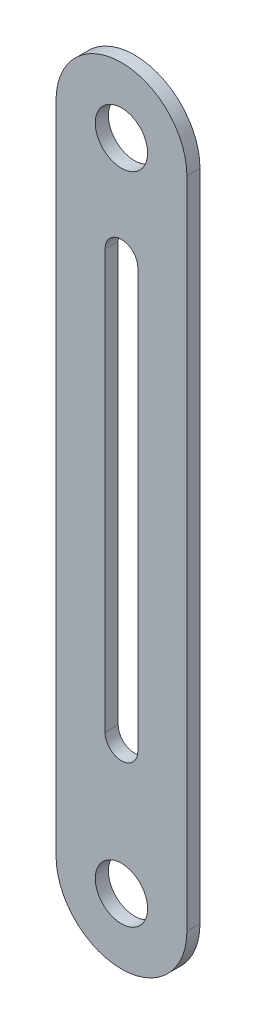
from build123d import *

# Parameters (mm, degrees)
SKETCH_1_R          = 8
EXTRUDE_1_DEPTH     = 4
CUT_EXTRUDE_2_DEPTH = 221.943431674


with BuildPart() as part:
    # 草图1 → 凸台-拉伸1 (new body)
    with BuildSketch(Plane.XY):
        with BuildLine():
            Line((-20, 0), (-20, -200))
            ThreePointArc((-20, -200), (0, -220), (20, -200))
            Line((20, -200), (20, 0))
            ThreePointArc((20, 0), (0, 20), (-20, 0))
        make_face()
        Circle(SKETCH_1_R, mode=Mode.SUBTRACT)
        with Locations((0, -200)):
            Circle(SKETCH_1_R, mode=Mode.SUBTRACT)
    extrude(amount=EXTRUDE_1_DEPTH)

    # 草图2 → 切除-拉伸2 (cut, through all)
    with BuildSketch(Plane.XY.offset(4)):
        with BuildLine():
            Line((-5, -31.845004689), (-5, -159.845004689))
            ThreePointArc((-5, -159.845004689), (0, -164.845004689), (5, -159.845004689))
            Line((5, -159.845004689), (5, -31.845004689))
            ThreePointArc((5, -31.845004689), (0, -26.845004689), (-5, -31.845004689))
        make_face()
    extrude(amount=-CUT_EXTRUDE_2_DEPTH, mode=Mode.SUBTRACT)


solid = part.part
